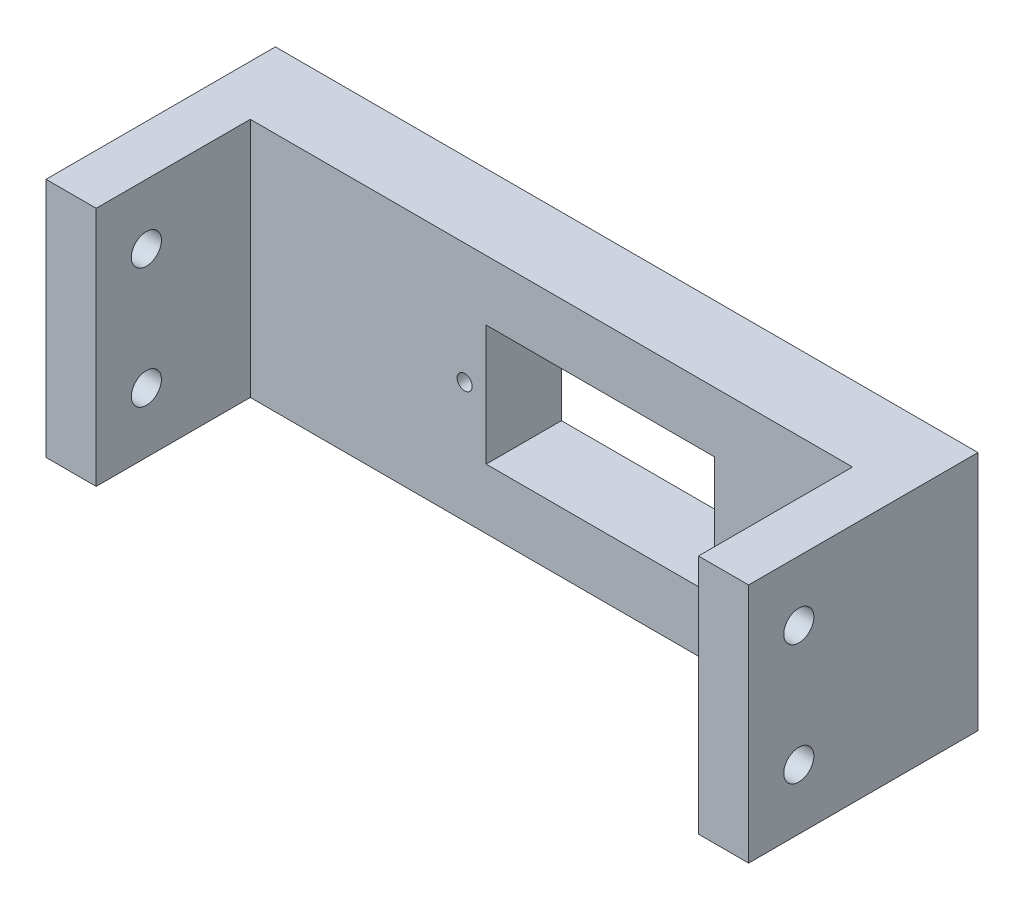
from build123d import *

# Parameters (mm, degrees)
SKETCH1_W           = 5
SKETCH1_H           = 15.35
BOSS_EXTRUDE1_DEPTH = 24
SKETCH2_R           = 1.5
CUT_EXTRUDE1_DEPTH  = 77.425192182
CUT_EXTRUDE4_REACH  = 50.199
SKETCH8_W           = 22.75
SKETCH8_H           = 12
SKETCH9_R           = 0.75
CUT_EXTRUDE5_DEPTH  = 49.198781105


with BuildPart() as part:
    # Sketch1 → Boss-Extrude1 (new body)
    with BuildSketch(Plane(origin=(0, 0, 0), x_dir=(1, 0, 0), z_dir=(0, 1, 0))):
        with Locations((-32.5, -11.425)):
            Rectangle(SKETCH1_W, SKETCH1_H)
        Polygon((-35, -3.75), (-30, -3.75), (0, -3.75), (0, 3.75), (-35, 3.75), align=None)
        Polygon((0, 3.75), (0, -3.75), (30, -3.75), (35, -3.75), (35, 3.75), align=None)
        with Locations((32.5, -11.425)):
            Rectangle(SKETCH1_W, SKETCH1_H)
    extrude(amount=BOSS_EXTRUDE1_DEPTH)

    # Sketch2 → Cut-Extrude1 (cut, through all)
    with BuildSketch(Plane.ZY.offset(35)):
        with Locations((14.1, 18)):
            Circle(SKETCH2_R)
        with Locations((14.1, 6)):
            Circle(SKETCH2_R)
    extrude(amount=-CUT_EXTRUDE1_DEPTH, mode=Mode.SUBTRACT)

    # Sketch8 → Cut-Extrude4 (cut, up to next)
    with BuildSketch(Plane(origin=(0, 0, -3.75), x_dir=(-1, 0, 0), z_dir=(0, 0, -1)), mode=Mode.PRIVATE) as cut_extrude4_sk1:
        with Locations((-4.875, 12)):
            Rectangle(SKETCH8_W, SKETCH8_H)
    cut_extrude4_tool1 = extrude(cut_extrude4_sk1.sketch, amount=-CUT_EXTRUDE4_REACH, mode=Mode.PRIVATE) & part.part
    add(cut_extrude4_tool1.solids().sort_by_distance((4.875, 12, -3.75))[0], mode=Mode.SUBTRACT)

    # Sketch9 → Cut-Extrude5 (cut, through all)
    with BuildSketch(Plane(origin=(0, 0, -3.75), x_dir=(-1, 0, 0), z_dir=(0, 0, -1))):
        with Locations((-19.16, 12)):
            Circle(SKETCH9_R)
        with Locations((8.64, 12)):
            Circle(SKETCH9_R)
    extrude(amount=-CUT_EXTRUDE5_DEPTH, mode=Mode.SUBTRACT)


solid = part.part
